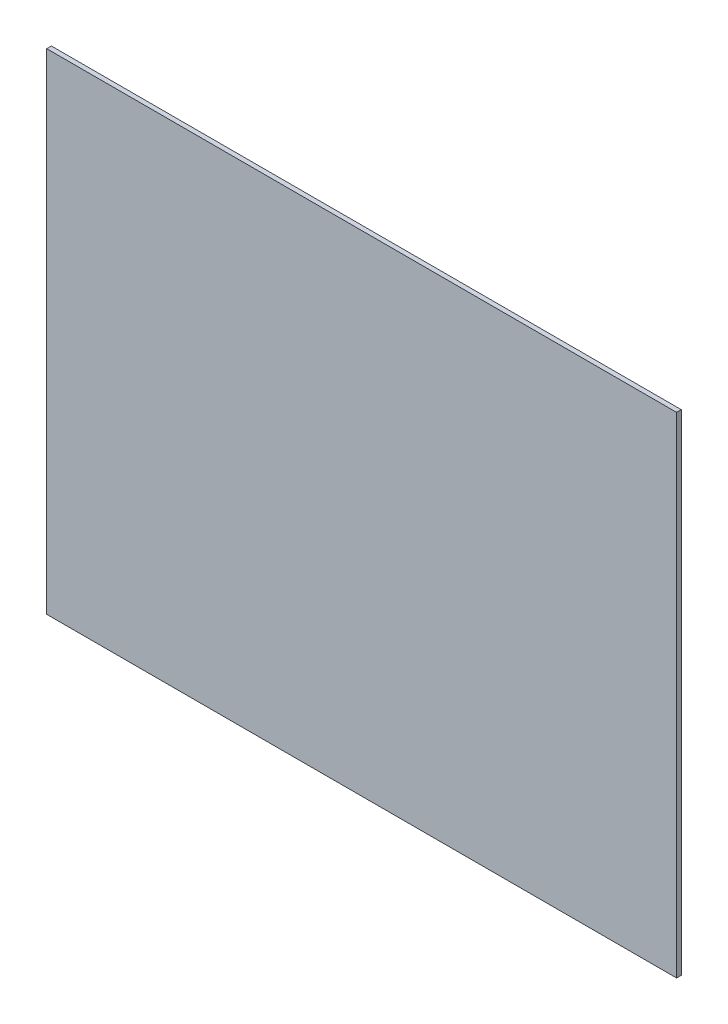
from build123d import *

# Parameters (mm, degrees)
SKETCH_1_W      = 540
SKETCH_1_H      = 420
EXTRUDE_1_DEPTH = 4


with BuildPart() as part:
    # Эскиз1 → Бобышка-Вытянуть1 (new body)
    with BuildSketch(Plane.XY):
        Rectangle(SKETCH_1_W, SKETCH_1_H)
    extrude(amount=EXTRUDE_1_DEPTH)


solid = part.part
